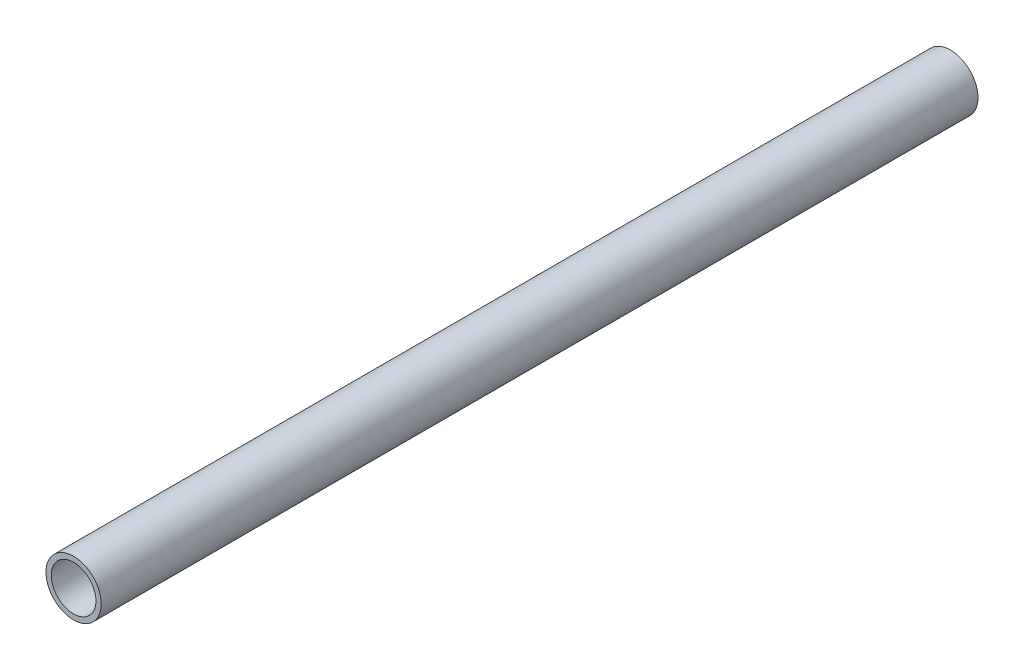
from build123d import *

# Parameters (mm, degrees)
SKETCH1_R           = 8.001
SKETCH1_R_2         = 6.477
BOSS_EXTRUDE1_DEPTH = 254


with BuildPart() as part:
    # Sketch1 → Boss-Extrude1 (new body)
    with BuildSketch(Plane.XY):
        Circle(SKETCH1_R)
        Circle(SKETCH1_R_2, mode=Mode.SUBTRACT)
    extrude(amount=-BOSS_EXTRUDE1_DEPTH)


solid = part.part
